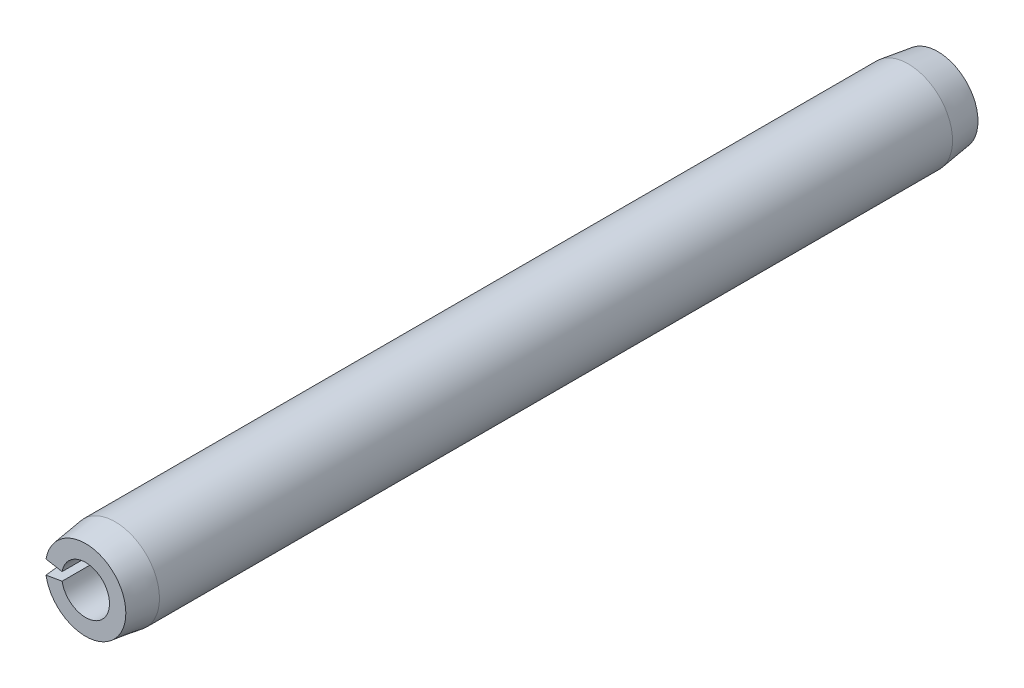
from build123d import *

# Parameters (mm, degrees)
EXTRUDE1_DEPTH      = 9.525
EXTRUDE1_DEPTH_BACK = 9.525


with BuildPart() as part:
    # Sketch1 → Extrude1 (new, two sides: drawn at the far end of the back side and taken through both)
    with BuildSketch(Plane.XY.offset(-EXTRUDE1_DEPTH_BACK)):
        with BuildLine():
            Line((-0.525296455, -0.092623938), (-0.97555056, -0.172015885))
            ThreePointArc((-0.97555056, -0.172015885), (0.9906, 0), (-0.97555056, 0.172015885))
            Line((-0.97555056, 0.172015885), (-0.525296455, 0.092623938))
            ThreePointArc((-0.525296455, 0.092623938), (0.5334, 0), (-0.525296455, -0.092623938))
        make_face()
    extrude(amount=EXTRUDE1_DEPTH + EXTRUDE1_DEPTH_BACK)

    # Sketch2 → Cut-Revolve1 (revolve, cut)
    with BuildSketch(Plane(origin=(0, 0, 0), x_dir=(0, 0, -1), z_dir=(1, 0, 0))):
        Polygon((9.525, 0.89916), (8.8646, 0.9906), (9.525, 0.9906), align=None)
    cut_revolve1 = revolve(axis=Axis((0, 0, -9.525), (0, 0, 1)), mode=Mode.SUBTRACT)

    # Mirror1: Cut-Revolve1 across plane
    add(cut_revolve1.mirror(Plane.XY), mode=Mode.SUBTRACT)


solid = part.part
